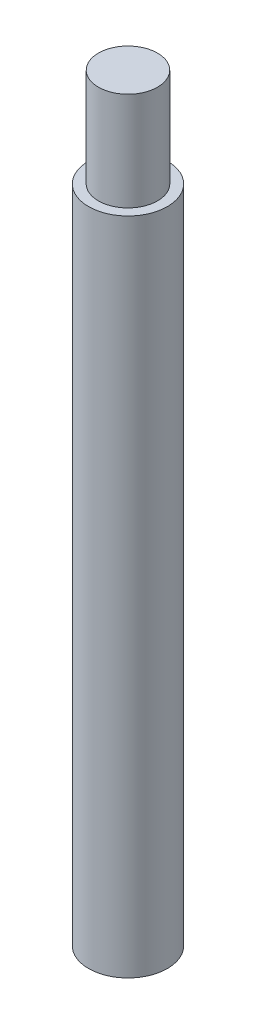
from build123d import *

# Parameters (mm, degrees)
EXTRUDE_START       = 65
SKETCH_1_R          = 8
EXTRUDE_1_DEPTH     = 154
SKETCH_2_R          = 10
SKETCH_2_R_2        = 6
CUT_EXTRUDE_1_DEPTH = 20


with BuildPart() as part:
    # Эскиз1 → Вытянуть1 (new body)
    with BuildSketch(Plane(origin=(0, 0, 0), x_dir=(1, 0, 0), z_dir=(0, 1, 0)).offset(EXTRUDE_START)):
        Circle(SKETCH_1_R)
    extrude(amount=EXTRUDE_1_DEPTH)

    # Эскиз2 → Вырез-Вытянуть1 (cut)
    with BuildSketch(Plane(origin=(0, 219, 0), x_dir=(1, 0, 0), z_dir=(0, 1, 0))):
        Circle(SKETCH_2_R)
        Circle(SKETCH_2_R_2, mode=Mode.SUBTRACT)
    extrude(amount=-CUT_EXTRUDE_1_DEPTH, mode=Mode.SUBTRACT)


solid = part.part
